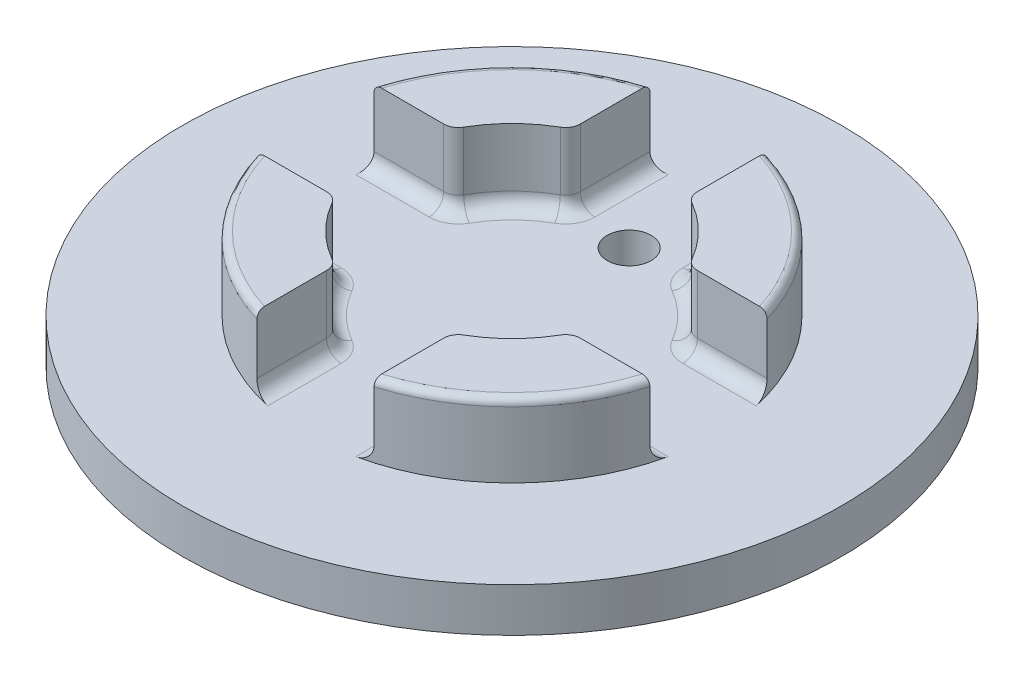
from build123d import *

# Parameters (mm, degrees)
SKETCH2_R           = 22.5
BOSS_EXTRUDE1_DEPTH = 3
BOSS_EXTRUDE2_DEPTH = 5
FILLET1_R           = 1
FILLET2_R           = 0.5
SKETCH5_R           = 1.5
CUT_EXTRUDE1_DEPTH  = 5


with BuildPart() as part:
    # Sketch2 → Boss-Extrude1 (new body)
    with BuildSketch(Plane(origin=(0, 0, 0), x_dir=(1, 0, 0), z_dir=(0, 1, 0))):
        with Locations(Location((0, 0, 0), (0, 0, 270))):
            Circle(SKETCH2_R)
    extrude(amount=BOSS_EXTRUDE1_DEPTH)

    # Sketch3 → Boss-Extrude2 (add)
    with BuildSketch(Plane(origin=(0, 3, 0), x_dir=(1, 0, 0), z_dir=(0, 1, 0))):
        with BuildLine():
            ThreePointArc((-4, 13.416407865), (-9.899494937, 9.899494937), (-13.416407865, 4))
            Line((-13.416407865, 4), (-8.062257748, 4))
            ThreePointArc((-8.062257748, 4), (-6.363961031, 6.363961031), (-4, 8.062257748))
            Line((-4, 8.062257748), (-4, 13.416407865))
        make_face()
        with BuildLine():
            ThreePointArc((13.416407865, 4), (9.899494937, 9.899494937), (4, 13.416407865))
            Line((4, 13.416407865), (4, 8.062257748))
            ThreePointArc((4, 8.062257748), (6.363961031, 6.363961031), (8.062257748, 4))
            Line((8.062257748, 4), (13.416407865, 4))
        make_face()
        with BuildLine():
            Line((4, -8.062257748), (4, -13.416407865))
            ThreePointArc((4, -13.416407865), (9.899494937, -9.899494937), (13.416407865, -4))
            Line((13.416407865, -4), (8.062257748, -4))
            ThreePointArc((8.062257748, -4), (6.363961031, -6.363961031), (4, -8.062257748))
        make_face()
        with BuildLine():
            Line((-8.062257748, -4), (-13.416407865, -4))
            ThreePointArc((-13.416407865, -4), (-9.899494937, -9.899494937), (-4, -13.416407865))
            Line((-4, -13.416407865), (-4, -8.062257748))
            ThreePointArc((-4, -8.062257748), (-6.363961031, -6.363961031), (-8.062257748, -4))
        make_face()
    extrude(amount=BOSS_EXTRUDE2_DEPTH)

    # Fillet1
    fillet1_edges = [part.edges().sort_by_distance(p)[0] for p in [
        (-6.363961031, 3, -6.363961031),
        (-4, 3, -10.739332807),
        (4, 5.5, -8.062257748),
        (10.739332807, 3, -4),
        (8.062257748, 5.5, -4),
        (4, 3, -10.739332807),
        (6.363961031, 3, -6.363961031),
        (8.062257748, 5.5, 4),
        (4, 3, 10.739332807),
        (4, 5.5, 8.062257748),
        (6.363961031, 3, 6.363961031),
        (10.739332807, 3, 4),
        (-4, 5.5, 8.062257748),
        (-8.062257748, 5.5, 4),
        (-6.363961031, 3, 6.363961031),
        (-4, 3, 10.739332807),
        (-10.739332807, 3, 4),
        (-8.062257748, 5.5, -4),
        (-4, 5.5, -8.062257748),
        (-10.739332807, 3, -4),
    ]]
    fillet(fillet1_edges, radius=FILLET1_R)

    # Fillet2
    fillet2_edges = [part.edges().sort_by_distance(p)[0] for p in [
        (9.899494937, 8, -9.899494937),
        (9.899494937, 8, 9.899494937),
        (-9.899494937, 8, 9.899494937),
        (-9.899494937, 8, -9.899494937),
    ]]
    fillet(fillet2_edges, radius=FILLET2_R)

    # Sketch5 → Cut-Extrude1 (cut)
    with BuildSketch(Plane(origin=(0, 3, 0), x_dir=(1, 0, 0), z_dir=(0, 1, 0))):
        with Locations(Location((0, 8, 0), (0, 0, 270))):
            Circle(SKETCH5_R)
    extrude(amount=-CUT_EXTRUDE1_DEPTH, mode=Mode.SUBTRACT)


solid = part.part
